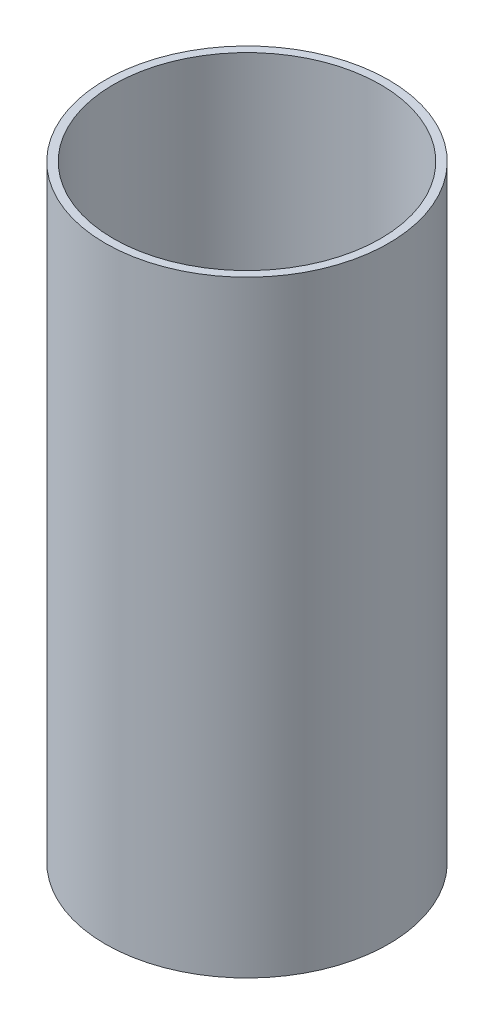
from build123d import *

# Parameters (mm, degrees)
SKETCH_1_W = 4
SKETCH_1_H = 300


with BuildPart() as part:
    # Эскиз1 → Повернуть-Тонкостенный1 (revolve)
    with BuildSketch(Plane.XY):
        with Locations((-68, 150)):
            Rectangle(SKETCH_1_W, SKETCH_1_H)
    revolve(axis=Axis((0, 26.168985987, 0), (0, -1, 0)))


solid = part.part
